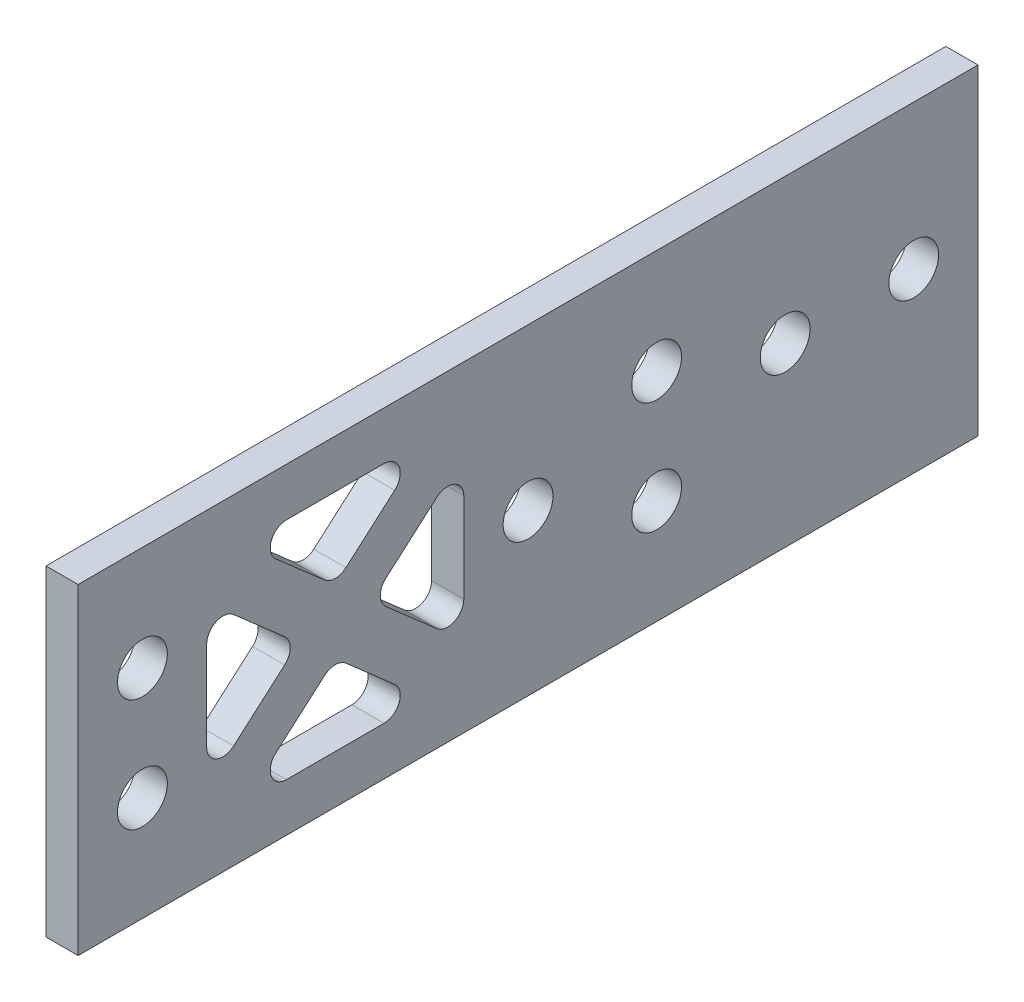
from build123d import *

# Parameters (mm, degrees)
SKETCH_1_R      = 1.55
EXTRUDE_1_DEPTH = 2
FILLET_1_R      = 1.01


with BuildPart() as part:
    # 草图1 → 凸台-拉伸1 (new body)
    with BuildSketch(Plane(origin=(0, 0, 0), x_dir=(0, 0, -1), z_dir=(1, 0, 0))):
        Polygon((20, -10), (-20, -10), (-20, 10), (20, 10), (36, 10), (36, -10), align=None)
        with Locations((8, 0)):
            Circle(SKETCH_1_R, mode=Mode.SUBTRACT)
        with Locations((16, 3.5)):
            Circle(SKETCH_1_R, mode=Mode.SUBTRACT)
        with Locations((16, -3.5)):
            Circle(SKETCH_1_R, mode=Mode.SUBTRACT)
        with Locations(Location((-16, -3.5, 0), (0, 0, 180))):
            Circle(SKETCH_1_R, mode=Mode.SUBTRACT)
        with Locations(Location((-16, 3.5, 0), (0, 0, 180))):
            Circle(SKETCH_1_R, mode=Mode.SUBTRACT)
        with Locations((24, 1)):
            Circle(SKETCH_1_R, mode=Mode.SUBTRACT)
        with Locations((32, 1)):
            Circle(SKETCH_1_R, mode=Mode.SUBTRACT)
        Polygon((-12, -5.00684766), (-6.277888388, 0), (-12, 5.00684766), align=None, mode=Mode.SUBTRACT)
        Polygon((-9.722111612, -7), (-4, -1.99315234), (1.722111612, -7), align=None, mode=Mode.SUBTRACT)
        Polygon((-9.722111612, 7), (-4, 1.99315234), (1.722111612, 7), align=None, mode=Mode.SUBTRACT)
        Polygon((4, 5.00684766), (4, -5.00684766), (-1.722111612, 0), align=None, mode=Mode.SUBTRACT)
    extrude(amount=EXTRUDE_1_DEPTH)

    # 圆角1
    fillet_1_edges = [part.edges().sort_by_distance(p)[0] for p in [
        (1, 7, -1.722111612),
        (1, 7, 9.722111612),
        (1, 1.99315234, 4),
        (1, 5.00684766, 12),
        (1, -5.00684766, 12),
        (1, 0, 6.277888388),
        (1, -7, 9.722111612),
        (1, -7, -1.722111612),
        (1, -1.99315234, 4),
        (1, 5.00684766, -4),
        (1, 0, 1.722111612),
        (1, -5.00684766, -4),
    ]]
    fillet(fillet_1_edges, radius=FILLET_1_R)


solid = part.part
